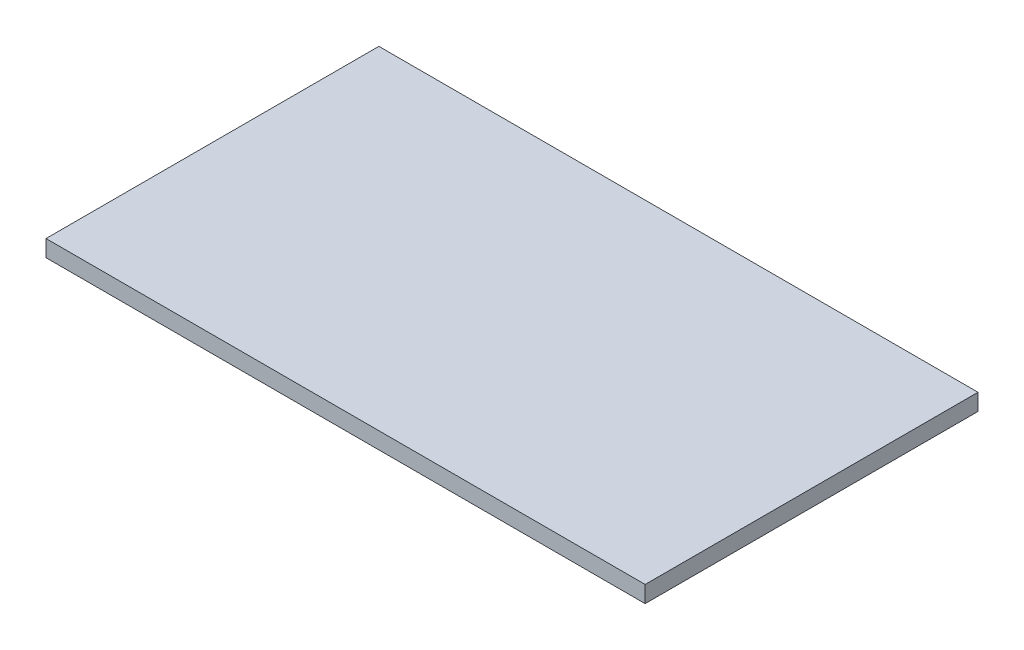
from build123d import *

# Parameters (mm, degrees)
SKETCH_1_W      = 180
SKETCH_1_H      = 100
EXTRUDE_1_DEPTH = 5


with BuildPart() as part:
    # 스케치1 → 보스-돌출1 (new body)
    with BuildSketch(Plane(origin=(0, 0, 0), x_dir=(1, 0, 0), z_dir=(0, 1, 0))):
        with Locations((90, 50)):
            Rectangle(SKETCH_1_W, SKETCH_1_H)
    extrude(amount=EXTRUDE_1_DEPTH)


solid = part.part
